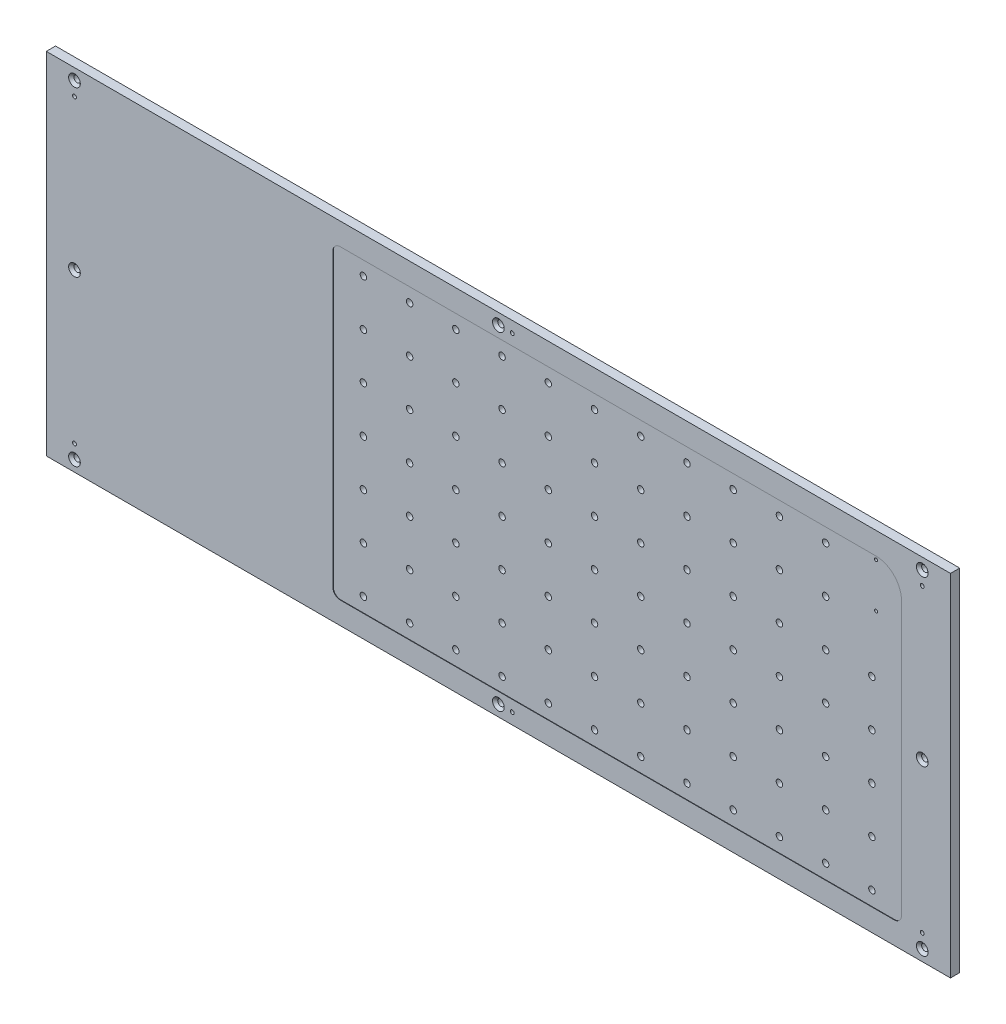
from build123d import *

# Parameters (mm, degrees)
BOSS_EXTRUDE1_DEPTH                             = 10
CSK_FOR_M6_FLAT_HEAD_MACHINE_SCREW1_D           = 7
CSK_FOR_M6_FLAT_HEAD_MACHINE_SCREW1_CSINK_D     = 12.6
CSK_FOR_M6_FLAT_HEAD_MACHINE_SCREW1_CSINK_ANGLE = 90
CUT_EXTRUDE1_DEPTH                              = 0.5
M4X0_7_TAPPED_HOLE1_D                           = 3.3
M8X1_0_TAPPED_HOLE1_D                           = 7
LPATTERN1_COUNT                                 = 11
LPATTERN1_PITCH                                 = 50
LPATTERN1_COUNT_DIR2                            = 2
LPATTERN1_PITCH_DIR2                            = 50
M8X1_0_TAPPED_HOLE2_D                           = 7
LPATTERN2_COUNT                                 = 12
LPATTERN2_PITCH                                 = 50
LPATTERN2_COUNT_DIR2                            = 5
LPATTERN2_PITCH_DIR2                            = 50
M5X0_8_TAPPED_HOLE1_D                           = 4.2


with BuildPart() as part:
    # Sketch1 → Boss-Extrude1 (new body)
    with BuildSketch(Plane.XY):
        Polygon((-421, -145), (-421, -524), (-171, -524), (428, -524), (489, -524), (489, -492), (489, -177), (489, -145), (428, -145), (-171, -145), align=None)
        Polygon((-489, -177), (-489, -492), (-489, -524), (-421, -524), (-421, -145), (-489, -145), align=None)
    extrude(amount=BOSS_EXTRUDE1_DEPTH)

    # CSK for M6 Flat Head Machine Screw1 (through all)
    with Locations(Plane(origin=(458.5, -157, 10), x_dir=(1, 0, 0), z_dir=(0, 0, 1))):
        with Locations((0, 0), (0, -177.5), (0, -355), (-917, 0), (-917, -177.5), (-917, -355), (-458.5, 0), (-458.5, -355)):
            CounterSinkHole(CSK_FOR_M6_FLAT_HEAD_MACHINE_SCREW1_D / 2, CSK_FOR_M6_FLAT_HEAD_MACHINE_SCREW1_CSINK_D / 2, counter_sink_angle=CSK_FOR_M6_FLAT_HEAD_MACHINE_SCREW1_CSINK_ANGLE)

    # Sketch7 → Cut-Extrude1 (cut)
    with BuildSketch(Plane.XY.offset(10)):
        with BuildLine():
            Line((-179, -177), (-179, -492))
            ThreePointArc((-179, -492), (-176.656854249, -497.656854249), (-171, -500))
            Line((-171, -500), (428, -500))
            ThreePointArc((428, -500), (433.656854249, -497.656854249), (436, -492))
            Line((436, -492), (436, -197))
            ThreePointArc((436, -197), (427.798989873, -177.201010127), (408, -169))
            Line((408, -169), (-171, -169))
            ThreePointArc((-171, -169), (-176.656854249, -171.343145751), (-179, -177))
        make_face()
    extrude(amount=-CUT_EXTRUDE1_DEPTH, mode=Mode.SUBTRACT)

    # M4x0.7 Tapped Hole1 (through all)
    with Locations(Plane(origin=(408, -173, 9.5), x_dir=(1, 0, 0), z_dir=(0, 0, 1))):
        with Locations((0, 0), (0, -48)):
            Hole(M4X0_7_TAPPED_HOLE1_D / 2)

    # M8x1.0 Tapped Hole1 (through all)
    with Locations(Plane(origin=(-146.5, -184.5, 9.5), x_dir=(1, 0, 0), z_dir=(0, 0, 1))):
        with Locations((0, 0)):
            m8x1_0_tapped_hole1 = Hole(M8X1_0_TAPPED_HOLE1_D / 2)

    # LPattern1: M8x1.0 Tapped Hole1 11 × 2
    with Locations(*[(i * LPATTERN1_PITCH, -j * LPATTERN1_PITCH_DIR2, 0) for i in range(LPATTERN1_COUNT) for j in range(LPATTERN1_COUNT_DIR2) if (i, j) != (0, 0)]):
        add(m8x1_0_tapped_hole1, mode=Mode.SUBTRACT)

    # M8x1.0 Tapped Hole2 (through all)
    with Locations(Plane(origin=(-146.5, -484.5, 9.5), x_dir=(1, 0, 0), z_dir=(0, 0, 1))):
        with Locations((0, 0)):
            m8x1_0_tapped_hole2 = Hole(M8X1_0_TAPPED_HOLE2_D / 2)

    # LPattern2: M8x1.0 Tapped Hole2 12 × 5
    with Locations(*[(i * LPATTERN2_PITCH, j * LPATTERN2_PITCH_DIR2, 0) for i in range(LPATTERN2_COUNT) for j in range(LPATTERN2_COUNT_DIR2) if (i, j) != (0, 0)]):
        add(m8x1_0_tapped_hole2, mode=Mode.SUBTRACT)

    # M5x0.8 Tapped Hole1 (through all)
    with Locations(Plane(origin=(-458.5, -497, 10), x_dir=(1, 0, 0), z_dir=(0, 0, 1))):
        with Locations((0, 0), (0, 325), (917, 325), (917, 0), (473.5, 340), (473.5, -15)):
            Hole(M5X0_8_TAPPED_HOLE1_D / 2)


solid = part.part
